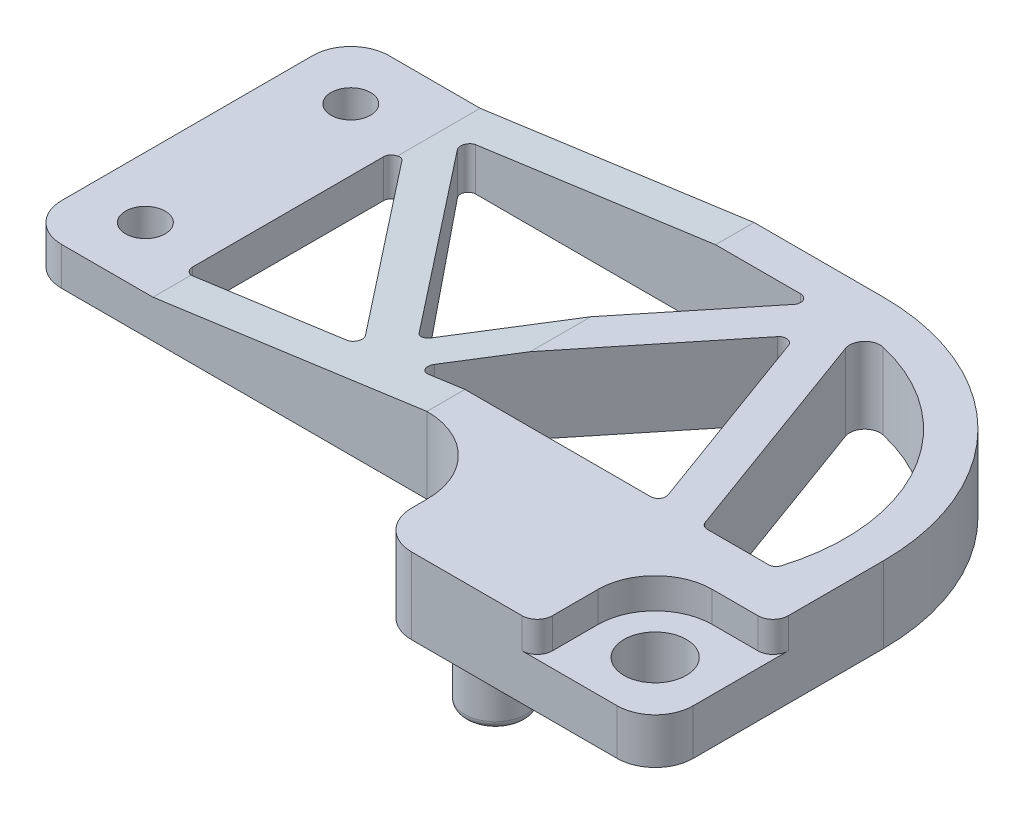
from build123d import *

# Parameters (mm, degrees)
SKETCH1_R           = 4.1
SKETCH1_R_2         = 4
SKETCH1_R_3         = 2.6
BOSS_EXTRUDE1_DEPTH = 10
CUT_EXTRUDE1_START  = -4
CUT_EXTRUDE1_DEPTH  = 4
FILLET1_R           = 2
BOSS_EXTRUDE2_START = -20
SKETCH3_R           = 4
BOSS_EXTRUDE2_DEPTH = 20
FILLET2_R           = 1
CUT_EXTRUDE2_REACH  = 75.469


with BuildPart() as part:
    # Sketch1 → Boss-Extrude1 (new body)
    with BuildSketch(Plane(origin=(0, 0, 0), x_dir=(1, 0, 0), z_dir=(0, 1, 0))):
        with BuildLine():
            Line((11.273947383, 72.313413723), (4.792068361, 72.313413723))
            Line((4.792068361, 72.313413723), (-53.726052617, 72.313413723))
            ThreePointArc((-53.726052617, 72.313413723), (-57.261586523, 70.848947629), (-58.726052617, 67.313413723))
            Line((-58.726052617, 67.313413723), (-58.726052617, 34.313413723))
            ThreePointArc((-58.726052617, 34.313413723), (-57.261586523, 30.777879817), (-53.726052617, 29.313413723))
            Line((-53.726052617, 29.313413723), (-5.726052617, 29.313413723))
            ThreePointArc((-5.726052617, 29.313413723), (1.345015195, 26.384481534), (4.273947383, 19.313413723))
            Line((4.273947383, 19.313413723), (4.273947383, 17.313413723))
            ThreePointArc((4.273947383, 17.313413723), (5.738413477, 13.777879817), (9.273947383, 12.313413723))
            Line((9.273947383, 12.313413723), (36.273947383, 12.313413723))
            ThreePointArc((36.273947383, 12.313413723), (39.809481289, 13.777879817), (41.273947383, 17.313413723))
            Line((41.273947383, 17.313413723), (41.273947383, 42.313413723))
            ThreePointArc((41.273947383, 42.313413723), (32.487150819, 63.526617158), (11.273947383, 72.313413723))
        make_face()
        with Locations(Location((33.273947383, 20.313413723, 0), (0, 0, 270))):
            Circle(SKETCH1_R, mode=Mode.SUBTRACT)
        with Locations(Location((12.273947383, 20.313413723, 0), (0, 0, 270))):
            Circle(SKETCH1_R_2, mode=Mode.SUBTRACT)
        with Locations(Location((-50.726052617, 64.313413723, 0), (0, 0, 270))):
            Circle(SKETCH1_R_3, mode=Mode.SUBTRACT)
        with Locations(Location((-50.726052617, 37.313413723, 0), (0, 0, 270))):
            Circle(SKETCH1_R_3, mode=Mode.SUBTRACT)
        with BuildLine():
            Line((34.171420048, 34.313413723), (26.134777641, 34.313413723))
            ThreePointArc((26.134777641, 34.313413723), (25.561526201, 34.49403421), (25.19535667, 34.97064815))
            Line((25.19535667, 34.97064815), (14.615821544, 63.966084002))
            ThreePointArc((14.615821544, 63.966084002), (14.998488248, 65.980552022), (16.952543045, 66.601989919))
            ThreePointArc((16.952543045, 66.601989919), (32.892900514, 54.755368869), (35.127730175, 35.021059585))
            ThreePointArc((35.127730175, 35.021059585), (34.766250218, 34.509562325), (34.171420048, 34.313413723))
        make_face(mode=Mode.SUBTRACT)
        with BuildLine():
            Line((-42.557674575, 35.313413723), (-42.557674575, 60.452375226))
            ThreePointArc((-42.557674575, 60.452375226), (-41.891342574, 61.395065879), (-40.780343242, 61.081466633))
            Line((-40.780343242, 61.081466633), (-20.435473581, 35.94250513))
            ThreePointArc((-20.435473581, 35.94250513), (-20.310283056, 34.882769674), (-21.212804914, 34.313413723))
            Line((-21.212804914, 34.313413723), (-41.557674575, 34.313413723))
            ThreePointArc((-41.557674575, 34.313413723), (-42.264781356, 34.606306941), (-42.557674575, 35.313413723))
        make_face(mode=Mode.SUBTRACT)
        with BuildLine():
            Line((-37.245793747, 67.251595954), (5.443945576, 67.251595954))
            ThreePointArc((5.443945576, 67.251595954), (6.346467434, 66.682240002), (6.221276909, 65.622504547))
            Line((6.221276909, 65.622504547), (-15.123592752, 39.247901728))
            ThreePointArc((-15.123592752, 39.247901728), (-15.900924085, 38.876993135), (-16.678255419, 39.247901728))
            Line((-16.678255419, 39.247901728), (-38.02312508, 65.622504547))
            ThreePointArc((-38.02312508, 65.622504547), (-38.148315604, 66.682240002), (-37.245793747, 67.251595954))
        make_face(mode=Mode.SUBTRACT)
        with BuildLine():
            Line((19.622800135, 35.656179295), (10.526467022, 60.58658882))
            ThreePointArc((10.526467022, 60.58658882), (9.751557094, 61.230198488), (8.809714717, 60.872914654))
            Line((8.809714717, 60.872914654), (-11.36637459, 35.94250513))
            ThreePointArc((-11.36637459, 35.94250513), (-11.491565114, 34.882769674), (-10.589043257, 34.313413723))
            Line((-10.589043257, 34.313413723), (18.683379163, 34.313413723))
            ThreePointArc((18.683379163, 34.313413723), (19.502758676, 34.740162282), (19.622800135, 35.656179295))
        make_face(mode=Mode.SUBTRACT)
    extrude(amount=BOSS_EXTRUDE1_DEPTH)

    # Sketch2 → Cut-Extrude1 (cut)
    with BuildSketch(Plane(origin=(0, 10, 0), x_dir=(1, 0, 0), z_dir=(0, 1, 0)).offset(CUT_EXTRUDE1_START)):
        with BuildLine():
            Line((33.273947383, 27.813413723), (41.273947383, 27.813413723))
            Line((41.273947383, 27.813413723), (41.273947383, 17.313413723))
            ThreePointArc((41.273947383, 17.313413723), (39.809481289, 13.777879817), (36.273947383, 12.313413723))
            Line((36.273947383, 12.313413723), (25.773947383, 12.313413723))
            Line((25.773947383, 12.313413723), (25.773947383, 20.313413723))
            ThreePointArc((25.773947383, 20.313413723), (27.970646524, 25.616714582), (33.273947383, 27.813413723))
        make_face()
    extrude(amount=CUT_EXTRUDE1_DEPTH, mode=Mode.SUBTRACT)

    # Fillet1
    fillet1_edges = [part.edges().sort_by_distance(p)[0] for p in [
        (41.273947383, 8, -27.813413723),
        (25.773947383, 8, -12.313413723),
    ]]
    fillet(fillet1_edges, radius=FILLET1_R)

    # Sketch3 → Boss-Extrude2 (add)
    with BuildSketch(Plane(origin=(0, 10, 0), x_dir=(1, 0, 0), z_dir=(0, 1, 0)).offset(BOSS_EXTRUDE2_START)):
        with Locations(Location((12.273947383, 20.313413723, 0), (0, 0, 270))):
            Circle(SKETCH3_R)
    extrude(amount=BOSS_EXTRUDE2_DEPTH)

    # Fillet2
    fillet2_edges = [part.edges().sort_by_distance(p)[0] for p in [
        (12.273947383, -10, -24.313413723),
        (12.273947383, 0, -24.313413723),
    ]]
    fillet(fillet2_edges, radius=FILLET2_R)

    # Cut-Extrude2: up to this face of the body (flat: up to its plane)
    cut_extrude2_end = Plane(part.part.faces().sort_by_distance((-21.226052617, 5, -72.313413723))[0])
    # Sketch4 → Cut-Extrude2 (cut, up to the picked face)
    with BuildSketch(Plane.XY.offset(-29.313413723), mode=Mode.PRIVATE) as cut_extrude2_sk1:
        Polygon((-5.726052617, 10), (-41.726052617, 5), (-62.366339881, 5), (-62.366339881, 10), align=None)
    cut_extrude2_tool1 = split(extrude(cut_extrude2_sk1.sketch, amount=-CUT_EXTRUDE2_REACH, mode=Mode.PRIVATE), bisect_by=cut_extrude2_end, keep=Keep.BOTH, mode=Mode.PRIVATE)
    add(cut_extrude2_tool1.solids().sort_by(Axis((-41.648691, 7.888196, -29.313414), (0, 0, -1)))[0], mode=Mode.SUBTRACT)


solid = part.part
